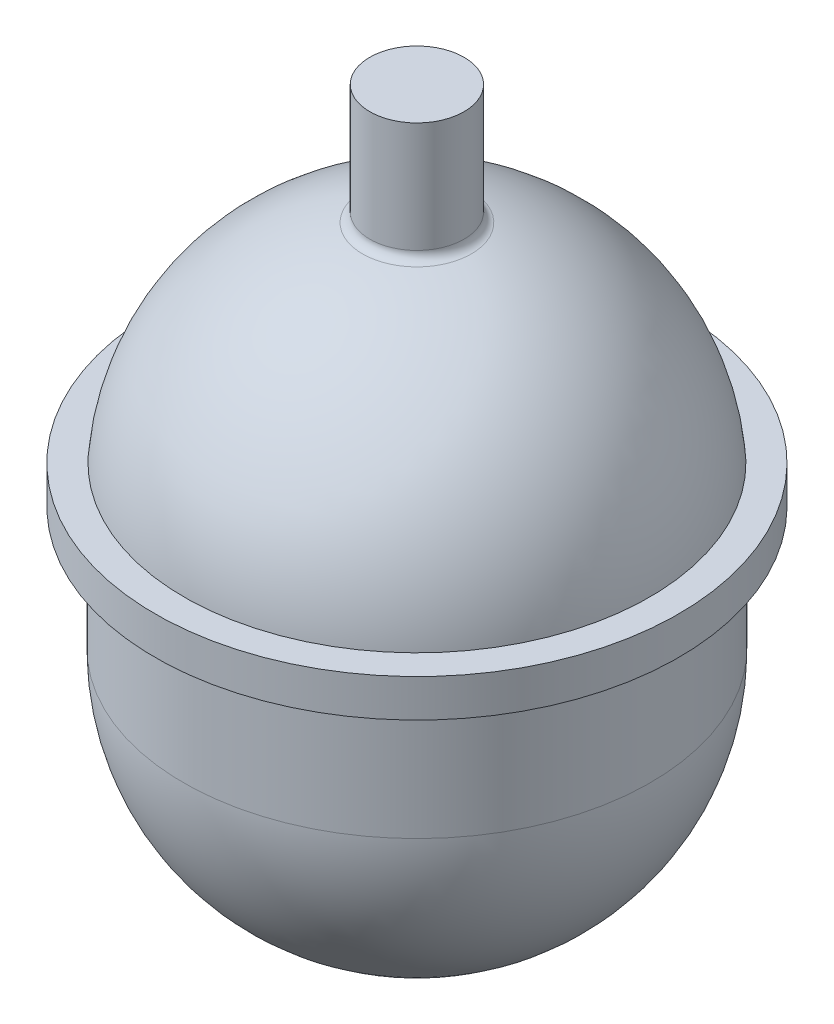
from build123d import *

# Parameters (mm, degrees)
SKETCH2_R           = 10
BOSS_EXTRUDE1_DEPTH = 26
SKETCH3_R           = 5
SKETCH3_R_2         = 2
BOSS_EXTRUDE2_DEPTH = 5
FILLET1_R           = 2
FILLET3_R           = 1


with BuildPart() as part:
    # Sketch1 → Revolve2 (revolve)
    with BuildSketch(Plane.XY, mode=Mode.PRIVATE) as revolve2_sk:
        with BuildLine():
            Line((-55.5, -4), (-49.5, -4))
            Line((-49.5, -4), (-49.5, -30))
            ThreePointArc((-49.5, -30), (-35.001785669, -65.001785669), (0, -79.5))
            Line((0, -79.5), (0, -75.5))
            ThreePointArc((0, -75.5), (-32.173358544, -62.173358544), (-45.5, -30))
            Line((-45.5, -30), (-45.5, 0))
            ThreePointArc((-45.5, 0), (-32.173358544, 32.173358544), (0, 45.5))
            Line((0, 45.5), (0, 49.5))
            ThreePointArc((0, 49.5), (-33.557785982, 36.388528412), (-49.338119137, 4))
            Line((-49.338119137, 4), (-55.5, 4))
            Line((-55.5, 4), (-55.5, 0))
            Line((-55.5, 0), (-55.5, -4))
        make_face()
    revolve(revolve2_sk.sketch.rotate(Axis((0, -85.95, 0), (0, 1, 0)), 270), axis=Axis((0, -85.95, 0), (0, 1, 0)))

    # Sketch2 → Boss-Extrude1 (add)
    with BuildSketch(Plane(origin=(0, 47.5, 0), x_dir=(1, 0, 0), z_dir=(0, 1, 0))):
        with Locations(Location((0, 0, 0), (0, 0, 180))):
            Circle(SKETCH2_R)
    extrude(amount=BOSS_EXTRUDE1_DEPTH)

    # Sketch3 → Boss-Extrude2 (add)
    with BuildSketch(Plane(origin=(0, -77.5, 0), x_dir=(-1, 0, 0), z_dir=(0, -1, 0))):
        with Locations(Location((0, 0, 0), (0, 0, 270))):
            Circle(SKETCH3_R)
        with Locations(Location((0, 0, 0), (0, 0, 270))):
            Circle(SKETCH3_R_2, mode=Mode.SUBTRACT)
    extrude(amount=BOSS_EXTRUDE2_DEPTH)

    # Fillet1
    fillet1_edges = [part.edges().sort_by_distance(p)[0] for p in [
        (7.071067812, 48.479377059, 7.071067812),
    ]]
    fillet(fillet1_edges, radius=FILLET1_R)

    # Fillet3
    fillet3_edges = [part.edges().sort_by_distance(p)[0] for p in [
        (-4.999999999, -79.246827309, 0),
    ]]
    fillet(fillet3_edges, radius=FILLET3_R)


solid = part.part
